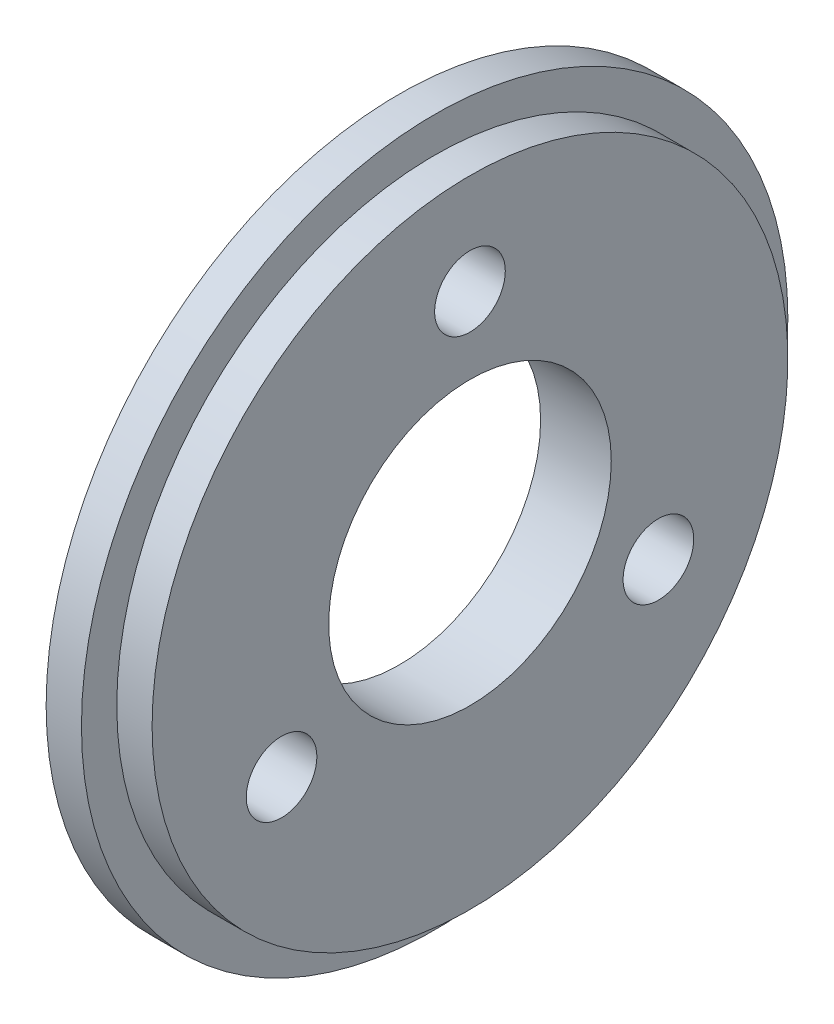
from build123d import *

# Parameters (mm, degrees)
SKETCH4_R          = 3.4925
SKETCH4_R_2        = 25.4
CUT_EXTRUDE1_DEPTH = 91.696141042
SKETCH4_3_R        = 6.35
SKETCH4_3_R_2      = 3.4925
CUT_EXTRUDE2_DEPTH = 10.16


with BuildPart() as part:
    # Sketch1 → Revolve1 (revolve)
    with BuildSketch(Plane.XY):
        Polygon((0, 0), (0, 57.15), (-6.35, 57.15), (-6.35, 63.5), (-12.7, 63.5), (-12.7, 0), align=None)
    revolve(axis=Axis((0, 0, 0), (1, 0, 0)))

    # Sketch4 → Cut-Extrude1 (cut, through all)
    with BuildSketch(Plane(origin=(0, 0, 0), x_dir=(0, 0, -1), z_dir=(1, 0, 0))):
        with Locations((0, 39.116)):
            Circle(SKETCH4_R)
        with Locations((33.875449694, -19.558)):
            Circle(SKETCH4_R)
        with Locations((-33.875449694, -19.558)):
            Circle(SKETCH4_R)
        Circle(SKETCH4_R_2)
    extrude(amount=-CUT_EXTRUDE1_DEPTH, mode=Mode.SUBTRACT)

    # Sketch4<3> → Cut-Extrude2 (cut)
    # profile 1 of 3: a face of its own
    with BuildSketch(Plane(origin=(0, 0, 0), x_dir=(0, 0, -1), z_dir=(1, 0, 0))):
        with Locations((0, 39.116)):
            Circle(SKETCH4_3_R)
        with Locations((0, 39.116)):
            Circle(SKETCH4_3_R_2, mode=Mode.SUBTRACT)
    # profile 2 of 3: a face of its own
    with BuildSketch(Plane(origin=(0, 0, 0), x_dir=(0, 0, -1), z_dir=(1, 0, 0))):
        with Locations((33.875449694, -19.558)):
            Circle(SKETCH4_3_R)
        with Locations((33.875449694, -19.558)):
            Circle(SKETCH4_3_R_2, mode=Mode.SUBTRACT)
    # profile 3 of 3: a face of its own
    with BuildSketch(Plane(origin=(0, 0, 0), x_dir=(0, 0, -1), z_dir=(1, 0, 0))):
        with Locations((-33.875449694, -19.558)):
            Circle(SKETCH4_3_R)
        with Locations((-33.875449694, -19.558)):
            Circle(SKETCH4_3_R_2, mode=Mode.SUBTRACT)
    extrude(amount=-CUT_EXTRUDE2_DEPTH, mode=Mode.SUBTRACT)


solid = part.part
